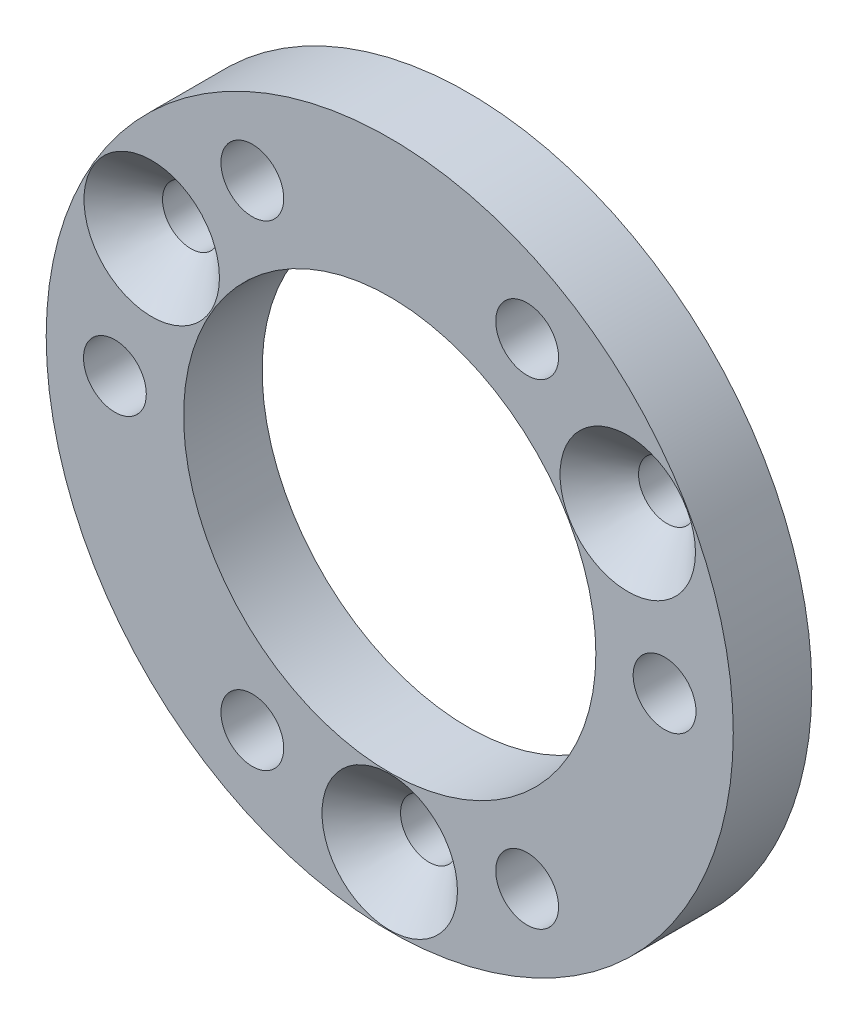
from build123d import *

# Parameters (mm, degrees)
SKETCH1_R           = 17.5
BOSS_EXTRUDE1_DEPTH = 4
SKETCH2_R           = 10.5
CUT_EXTRUDE1_DEPTH  = 26.069902273
SKETCH3_R           = 1.6
CUT_EXTRUDE2_DEPTH  = 26.069902273
SKETCH4_R           = 1.45
CUT_EXTRUDE3_DEPTH  = 26.069902273
CHAMFER1_SIZE       = 2


with BuildPart() as part:
    # Sketch1 → Boss-Extrude1 (new body)
    with BuildSketch(Plane.XY):
        Circle(SKETCH1_R)
    extrude(amount=BOSS_EXTRUDE1_DEPTH)

    # Sketch2 → Cut-Extrude1 (cut, through all)
    with BuildSketch(Plane.XY.offset(4)):
        Circle(SKETCH2_R)
    extrude(amount=-CUT_EXTRUDE1_DEPTH, mode=Mode.SUBTRACT)

    # Sketch3 → Cut-Extrude2 (cut, through all)
    with BuildSketch(Plane.XY.offset(4)):
        with Locations((14, 0)):
            Circle(SKETCH3_R)
        with Locations((7, -12.124355653)):
            Circle(SKETCH3_R)
        with Locations((-7, -12.124355653)):
            Circle(SKETCH3_R)
        with Locations((-14, 0)):
            Circle(SKETCH3_R)
        with Locations((-7, 12.124355653)):
            Circle(SKETCH3_R)
        with Locations((7, 12.124355653)):
            Circle(SKETCH3_R)
    extrude(amount=-CUT_EXTRUDE2_DEPTH, mode=Mode.SUBTRACT)

    # Sketch4 → Cut-Extrude3 (cut, through all)
    with BuildSketch(Plane.XY.offset(4)):
        with Locations((12.124355653, 7)):
            Circle(SKETCH4_R)
        with Locations((0, -14)):
            Circle(SKETCH4_R)
        with Locations((-12.124355653, 7)):
            Circle(SKETCH4_R)
    extrude(amount=-CUT_EXTRUDE3_DEPTH, mode=Mode.SUBTRACT)

    # Chamfer1
    chamfer1_edges = [part.edges().sort_by_distance(p)[0] for p in [
        (10.674355653, 7, 4),
        (-1.45, -14, 4),
        (-13.574355653, 7, 4),
    ]]
    chamfer(chamfer1_edges, length=CHAMFER1_SIZE)


solid = part.part
